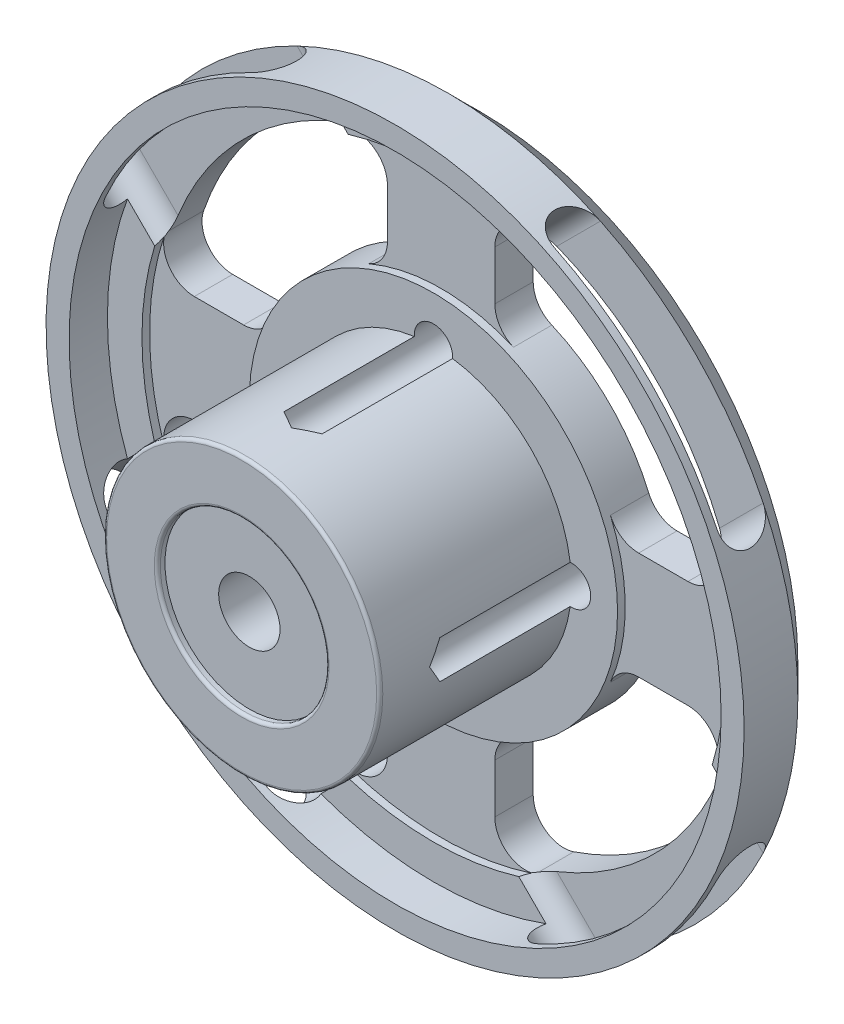
from build123d import *

# Parameters (mm, degrees)
SKETCH_1_R               = 22.75
EXTRUDE_1_DEPTH          = 5.5
SKETCH_2_R               = 21.25
CUT_EXTRUDE_1_DEPTH      = 2.5
SKETCH_3_R               = 19
SKETCH_3_R_2             = 12
CUT_EXTRUDE_2_DEPTH      = 33.64008272
EXTRUDE_2_DEPTH          = 2.5
SKETCH_5_R               = 9
EXTRUDE_3_DEPTH          = 12.5
SKETCH_6_R               = 5.5
CUT_EXTRUDE_3_DEPTH      = 0.5
SKETCH_7_R               = 5.5
CUT_EXTRUDE_4_DEPTH      = 0.5
SKETCH_8_R               = 2
CUT_EXTRUDE_5_DEPTH      = 36.498239393
M3X0_51_AT_2_COUNT       = 2
M3X0_51_AT_2_PITCH       = 18
M3X0_51_AT_3_COUNT       = 2
M3X0_51_AT_3_PITCH       = 12.727922061
M3X0_51_AT_4_COUNT       = 2
M3X0_51_AT_4_PITCH       = 12.727922061
CHAMFER_1_SIZE           = 2
FILLET_1_R               = 2
CUT_EXTRUDE_6_DEPTH      = 7
PATTERN_CIRCULAR_1_COUNT = 4
FILLET_2_R               = 0.2


with BuildPart() as part:
    # Эскиз1 → Бобышка-Вытянуть1 (new body)
    with BuildSketch(Plane.XY):
        Circle(SKETCH_1_R)
    extrude(amount=EXTRUDE_1_DEPTH)

    # Эскиз2 → Вырез-Вытянуть1 (cut)
    with BuildSketch(Plane.XY.offset(5.5)):
        Circle(SKETCH_2_R)
    extrude(amount=-CUT_EXTRUDE_1_DEPTH, mode=Mode.SUBTRACT)

    # Эскиз3 → Вырез-Вытянуть2 (cut, through all)
    with BuildSketch(Plane(origin=(0, 0, 0), x_dir=(-1, 0, 0), z_dir=(0, 0, -1))):
        Circle(SKETCH_3_R)
        Circle(SKETCH_3_R_2, mode=Mode.SUBTRACT)
    extrude(amount=-CUT_EXTRUDE_2_DEPTH, mode=Mode.SUBTRACT)


with BuildPart() as cut_extrude_2_piece_1:
    # of the separate pieces the step leaves, piece 1, a body of its own (cut_extrude_2_pieces)
    add(part.part.solids().sort_by_distance((22.75, 0, 0))[0])



with BuildPart() as cut_extrude_2_piece_2:
    # of the separate pieces the step leaves, piece 2, a body of its own (cut_extrude_2_pieces)
    add(part.part.solids().sort_by_distance((-12, 0, 0))[0])


with BuildPart() as cut_extrude_2_piece_1_1:
    add(cut_extrude_2_piece_1.part)

    add(cut_extrude_2_piece_2.part)  # Бобышка-Вытянуть2 merges Вырез-Вытянуть2 piece 2
    # Эскиз4 → Бобышка-Вытянуть2 (add)
    with BuildSketch(Plane(origin=(0, 0, 0), x_dir=(-1, 0, 0), z_dir=(0, 0, -1))):
        Polygon((-3.5, 20.358374904), (3.5, 20.358374904), (3.5, 3.5), (20.003474549, 3.5), (20.003474549, -3.5), (3.5, -3.5), (3.5, -20.358374904), (-3.5, -20.358374904), (-3.5, -3.5), (-20.003474549, -3.5), (-20.003474549, 3.5), (-3.5, 3.5), align=None)
    extrude(amount=-EXTRUDE_2_DEPTH)

    # Эскиз5 → Бобышка-Вытянуть3 (add)
    with BuildSketch(Plane.XY.offset(3)):
        Circle(SKETCH_5_R)
    extrude(amount=EXTRUDE_3_DEPTH)

    # Эскиз6 → Вырез-Вытянуть3 (cut)
    with BuildSketch(Plane.XY.offset(15.5)):
        Circle(SKETCH_6_R)
    extrude(amount=-CUT_EXTRUDE_3_DEPTH, mode=Mode.SUBTRACT)

    # Эскиз7 → Вырез-Вытянуть4 (cut)
    with BuildSketch(Plane(origin=(0, 0, 0), x_dir=(-1, 0, 0), z_dir=(0, 0, -1))):
        with Locations(Location((0, 0, 0), (0, 0, 180))):
            Circle(SKETCH_7_R)
    extrude(amount=-CUT_EXTRUDE_4_DEPTH, mode=Mode.SUBTRACT)

    # Эскиз8 → Вырез-Вытянуть5 (cut, through all)
    with BuildSketch(Plane(origin=(0, 0, 0.5), x_dir=(-1, 0, 0), z_dir=(0, 0, -1))):
        Circle(SKETCH_8_R)
    extrude(amount=-CUT_EXTRUDE_5_DEPTH, mode=Mode.SUBTRACT)

    # Эскиз10 → Отверстие обработанное метчиком M3x0.51 (revolve, cut)
    with BuildSketch(Plane(origin=(0, 9, 0), x_dir=(0, 1, 0), z_dir=(1, 0, 0))):
        Polygon((0, 0), (0, 12.251075774), (1.25, 11.5), (1.25, 0), align=None)
    m3x0_51 = revolve(axis=Axis((0, 9, -6.35), (0, 0, 1)), mode=Mode.SUBTRACT)

    # Отверстие обработанное метчиком M3x0.51 at 2: Отверстие обработанное метчиком M3x0.51 ×2
    with Locations(*[(0, -i * M3X0_51_AT_2_PITCH, 0) for i in range(1, M3X0_51_AT_2_COUNT)]):
        add(m3x0_51, mode=Mode.SUBTRACT)

    # Отверстие обработанное метчиком M3x0.51 at 3: Отверстие обработанное метчиком M3x0.51 ×2
    with Locations(*[Vector(-0.7071067811865476, -0.7071067811865476, 0) * (i * M3X0_51_AT_3_PITCH) for i in range(1, M3X0_51_AT_3_COUNT)]):
        add(m3x0_51, mode=Mode.SUBTRACT)

    # Отверстие обработанное метчиком M3x0.51 at 4: Отверстие обработанное метчиком M3x0.51 ×2
    with Locations(*[Vector(0.7071067811865476, -0.7071067811865476, 0) * (i * M3X0_51_AT_4_PITCH) for i in range(1, M3X0_51_AT_4_COUNT)]):
        add(m3x0_51, mode=Mode.SUBTRACT)

    # Фаска1
    chamfer_1_edges = [cut_extrude_2_piece_1_1.edges().sort_by_distance(p)[0] for p in [
        (-22.75, 0, 0),
    ]]
    chamfer(chamfer_1_edges, length=CHAMFER_1_SIZE)

    # Скругление1
    fillet_1_edges = [cut_extrude_2_piece_1_1.edges().sort_by_distance(p)[0] for p in [
        (-3.5, 18.674849397, 1.25),
        (3.5, 18.674849397, 1.25),
        (18.674849397, 3.5, 1.25),
        (18.674849397, -3.5, 1.25),
        (3.5, -18.674849397, 1.25),
        (-3.5, -18.674849397, 1.25),
        (3.5, 11.478240283, 1.25),
        (-3.5, 11.478240283, 1.25),
        (-11.478240283, 3.5, 1.25),
        (-11.478240283, -3.5, 1.25),
        (-3.5, -11.478240283, 1.25),
        (3.5, -11.478240283, 1.25),
        (11.478240283, -3.5, 1.25),
        (11.478240283, 3.5, 1.25),
        (-18.674849397, -3.5, 1.25),
        (-18.674849397, 3.5, 1.25),
    ]]
    fillet(fillet_1_edges, radius=FILLET_1_R)

    # Эскиз12 → Вырез-Вытянуть6 (cut)
    with BuildSketch(Plane(origin=(16.086679272, -16.086679272, 0), x_dir=(0, 0, 1), z_dir=(0.7071067811865462, -0.7071067811865489, 0))):
        with BuildLine():
            Line((2, -7.5), (2, 7.5))
            ThreePointArc((2, 7.5), (3.5, 9), (5, 7.5))
            Line((5, 7.5), (5, -7.5))
            ThreePointArc((5, -7.5), (3.5, -9), (2, -7.5))
        make_face()
    cut_extrude_6 = extrude(amount=-CUT_EXTRUDE_6_DEPTH, mode=Mode.SUBTRACT)

    # Круговой массив1: Вырез-Вытянуть6 ×4 about axis
    pattern_circular_1_axis = Axis((0, 0, 15), (0, 0, -1))
    for i in range(1, PATTERN_CIRCULAR_1_COUNT):
        add(cut_extrude_6.rotate(pattern_circular_1_axis, i * 360 / PATTERN_CIRCULAR_1_COUNT), mode=Mode.SUBTRACT)

    # Скругление2
    fillet_2_edges = [cut_extrude_2_piece_1_1.edges().sort_by_distance(p)[0] for p in [
        (-9, 0, 15.5),
        (-5.5, 0, 15.5),
    ]]
    fillet(fillet_2_edges, radius=FILLET_2_R)


solid = cut_extrude_2_piece_1_1.part
